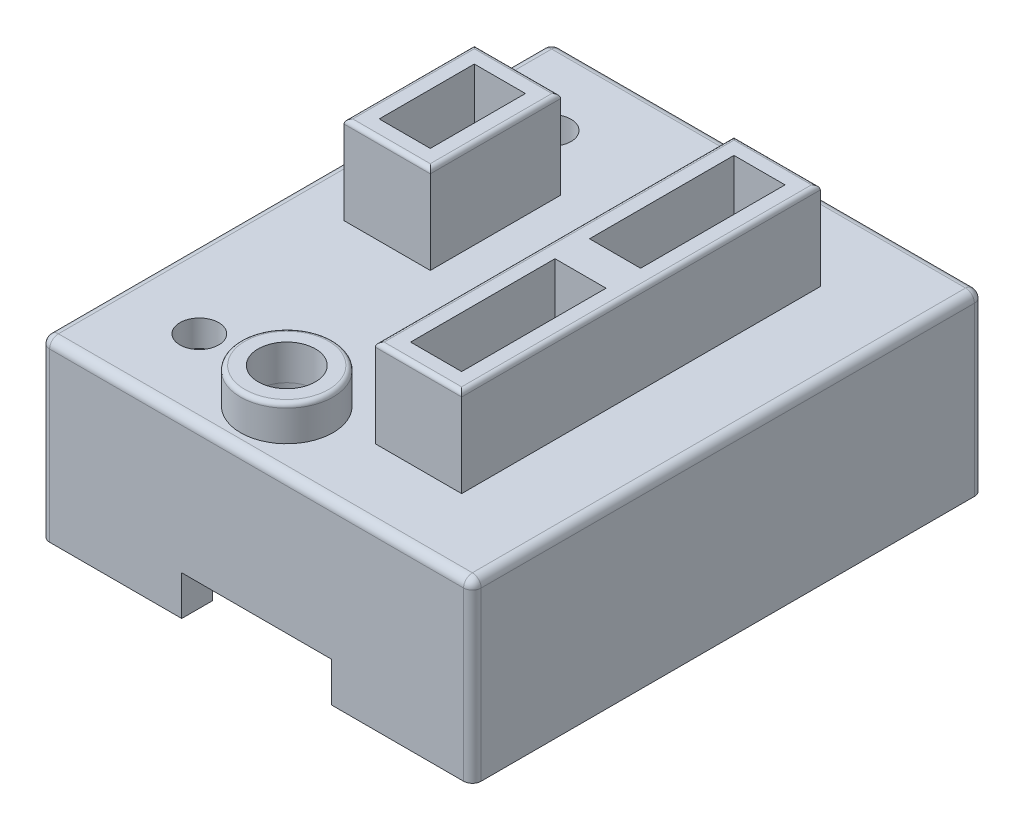
from build123d import *

# Parameters (mm, degrees)
SKETCH2_W           = 24.5
SKETCH2_H           = 29
BOSS_EXTRUDE1_DEPTH = 10
SKETCH3_W           = 21
SKETCH3_H           = 25.5
CUT_EXTRUDE1_DEPTH  = 8.5
SKETCH4_R           = 1.1
SKETCH4_R_2         = 1.625
SKETCH4_W           = 2.9
SKETCH4_H           = 5.4
SKETCH4_H_2         = 8.2
CUT_EXTRUDE2_DEPTH  = 22.454894546
SKETCH5_W           = 8.5
SKETCH5_H           = 2.25
CUT_EXTRUDE3_DEPTH  = 34.031235218
FILLET1_R           = 0.5
SKETCH6_W           = 1.5
SKETCH6_H           = 2
BOSS_EXTRUDE2_DEPTH = 2.7
FILLET2_R           = 0.5
SKETCH7_W           = 4.9
SKETCH7_H           = 7.4
SKETCH7_W_2         = 2.9
SKETCH7_H_2         = 5.4
SKETCH7_H_3         = 20.36
SKETCH7_H_4         = 8.2
BOSS_EXTRUDE3_DEPTH = 5
SKETCH8_R           = 2.625
SKETCH8_R_2         = 1.625
BOSS_EXTRUDE4_DEPTH = 2
FILLET3_R           = 0.25
FILLET4_R           = 0.25


with BuildPart() as part:
    # Sketch2 → Boss-Extrude1 (new body)
    with BuildSketch(Plane(origin=(0, 0, 0), x_dir=(1, 0, 0), z_dir=(0, 1, 0))):
        Rectangle(SKETCH2_W, SKETCH2_H)
    extrude(amount=-BOSS_EXTRUDE1_DEPTH)

    # Sketch3 → Cut-Extrude1 (cut)
    with BuildSketch(Plane.XZ.offset(10)):
        Rectangle(SKETCH3_W, SKETCH3_H)
    extrude(amount=-CUT_EXTRUDE1_DEPTH, mode=Mode.SUBTRACT)

    # Sketch4 → Cut-Extrude2 (cut, through all)
    with BuildSketch(Plane(origin=(0, 0, 0), x_dir=(1, 0, 0), z_dir=(0, 1, 0))):
        with Locations(Location((-7.75, -10, 0), (0, 0, 270))):
            Circle(SKETCH4_R)
        with Locations(Location((-7.75, 10, 0), (0, 0, 270))):
            Circle(SKETCH4_R)
        with Locations(Location((-1.7156, -11.0712, 0), (0, 0, 270))):
            Circle(SKETCH4_R_2)
        with Locations((-6.7576, 3.3688)):
            Rectangle(SKETCH4_W, SKETCH4_H)
        with Locations((5.1042, 4.84677)):
            Rectangle(SKETCH4_W, SKETCH4_H_2)
        with Locations((5.1042, -5.31323)):
            Rectangle(SKETCH4_W, SKETCH4_H_2)
    extrude(amount=-CUT_EXTRUDE2_DEPTH, mode=Mode.SUBTRACT)

    # Sketch5 → Cut-Extrude3 (cut, through all)
    with BuildSketch(Plane.XY.offset(14.5)):
        with Locations((0, -8.875)):
            Rectangle(SKETCH5_W, SKETCH5_H)
    extrude(amount=-CUT_EXTRUDE3_DEPTH, mode=Mode.SUBTRACT)

    # Fillet1
    fillet1_edges = [part.edges().sort_by_distance(p)[0] for p in [
        (0, 0, -14.5),
        (12.25, 0, 0),
        (0, 0, 14.5),
        (-12.25, 0, 0),
        (-12.25, -5, -14.5),
        (12.25, -5, -14.5),
        (12.25, -5, 14.5),
        (-12.25, -5, 14.5),
    ]]
    fillet(fillet1_edges, radius=FILLET1_R)

    # Sketch6 → Boss-Extrude2 (add)
    with BuildSketch(Plane.XZ.offset(1.5)):
        with Locations((-9.75, -3)):
            Rectangle(SKETCH6_W, SKETCH6_H)
        with Locations((9.75, 6.5)):
            Rectangle(SKETCH6_W, SKETCH6_H)
        with Locations((9.75, -5.5)):
            Rectangle(SKETCH6_W, SKETCH6_H)
    extrude(amount=BOSS_EXTRUDE2_DEPTH)

    # Fillet2
    fillet2_edges = [part.edges().sort_by_distance(p)[0] for p in [
        (-9.75, -1.5, -2),
        (9.75, -1.5, -6.5),
        (9.75, -1.5, 5.5),
        (-9, -1.5, -3),
        (9, -1.5, -5.5),
        (9, -1.5, 6.5),
        (-9.75, -1.5, -4),
        (-10.5, -2.85, -4),
        (-9, -2.85, -4),
        (-9, -2.85, -2),
        (-10.5, -2.85, -2),
        (9.75, -1.5, -4.5),
        (10.5, -2.85, -4.5),
        (9, -2.85, -4.5),
        (9, -2.85, -6.5),
        (10.5, -2.85, -6.5),
        (9.75, -1.5, 7.5),
        (10.5, -2.85, 7.5),
        (9, -2.85, 7.5),
        (9, -2.85, 5.5),
        (10.5, -2.85, 5.5),
    ]]
    fillet(fillet2_edges, radius=FILLET2_R)

    # Sketch7 → Boss-Extrude3 (add)
    # profile 1 of 2: a face of its own
    with BuildSketch(Plane(origin=(0, 0, 0), x_dir=(1, 0, 0), z_dir=(0, 1, 0))):
        with Locations((-6.7576, 3.3688)):
            Rectangle(SKETCH7_W, SKETCH7_H)
        with Locations((-6.7576, 3.3688)):
            Rectangle(SKETCH7_W_2, SKETCH7_H_2, mode=Mode.SUBTRACT)
    # profile 2 of 2: a face of its own
    with BuildSketch(Plane(origin=(0, 0, 0), x_dir=(1, 0, 0), z_dir=(0, 1, 0))):
        with Locations((5.1042, -0.23323)):
            Rectangle(SKETCH7_W, SKETCH7_H_3)
        with Locations((5.1042, -5.31323)):
            Rectangle(SKETCH7_W_2, SKETCH7_H_4, mode=Mode.SUBTRACT)
        with Locations((5.1042, 4.84677)):
            Rectangle(SKETCH7_W_2, SKETCH7_H_4, mode=Mode.SUBTRACT)
    extrude(amount=BOSS_EXTRUDE3_DEPTH)

    # Fillet3
    fillet3_edges = [part.edges().sort_by_distance(p)[0] for p in [
        (-6.7576, 5, 0.3312),
        (-4.3076, 5, -3.3688),
        (-6.7576, 5, -7.0688),
        (-9.2076, 5, -3.3688),
        (2.6542, 5, 0.23323),
        (5.1042, 5, 10.41323),
        (7.5542, 5, 0.23323),
        (5.1042, 5, -9.94677),
    ]]
    fillet(fillet3_edges, radius=FILLET3_R)


with BuildPart() as body_2:
    # Sketch8 → Boss-Extrude4 (new body)
    with BuildSketch(Plane(origin=(0, 0, 0), x_dir=(1, 0, 0), z_dir=(0, 1, 0))):
        with Locations(Location((-1.7156, -11.0712, 0), (0, 0, 270))):
            Circle(SKETCH8_R)
        with Locations(Location((-1.7156, -11.0712, 0), (0, 0, 270))):
            Circle(SKETCH8_R_2, mode=Mode.SUBTRACT)
    extrude(amount=BOSS_EXTRUDE4_DEPTH)

    # Fillet4
    fillet4_edges = [body_2.edges().sort_by_distance(p)[0] for p in [
        (-1.7156, 2, 8.4462),
    ]]
    fillet(fillet4_edges, radius=FILLET4_R)


solid = Compound([part.part, body_2.part])
